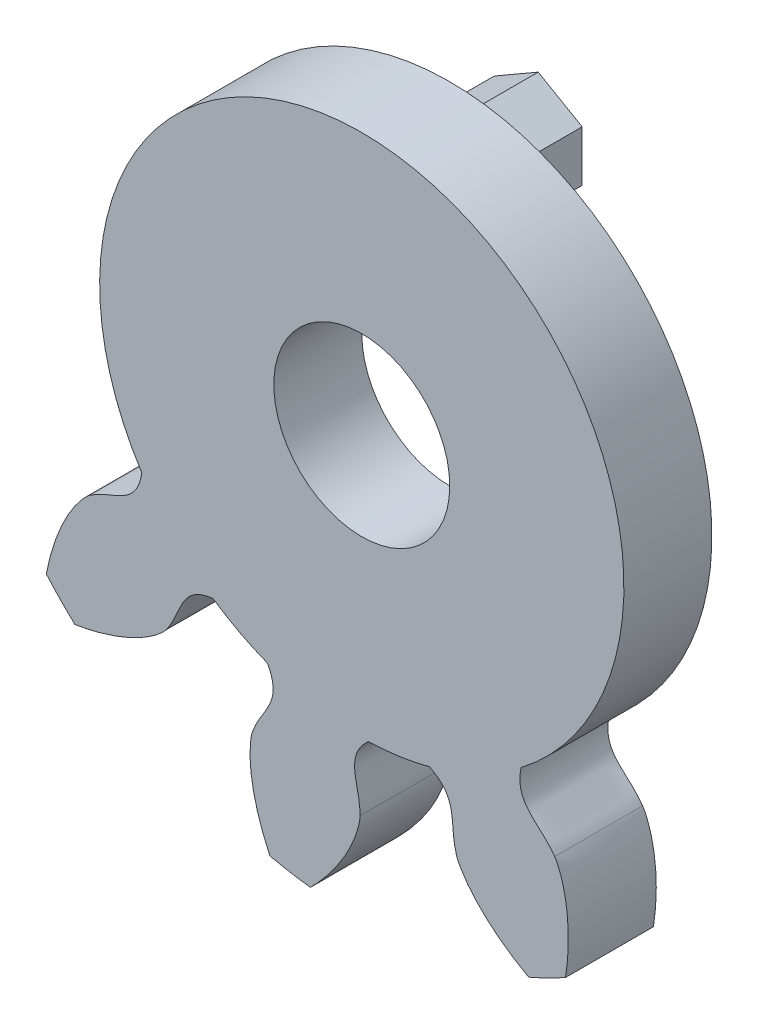
from build123d import *
from build123d.topology import SkipClean

# Parameters (mm, degrees)
EXTRUDE_1_DEPTH     = 5
SKETCH_5_R          = 5
CUT_EXTRUDE_1_DEPTH = 10
EXTRUDE_2_DEPTH     = 10
CUT_EXTRUDE_3_DEPTH = 10


with BuildPart() as part:
    # 草图4 → 凸台-拉伸1 (new body)
    with BuildSketch(Plane.XY):
        with BuildLine():
            ThreePointArc((20.566833542, -12.174373004), (21.13707452, -11.155002498), (21.656831226, -10.10898913))
            add(Edge.make_bspline(
                [(21.656831226, -10.10898913), (21.214973707, -9.252042912), (20.69173271, -8.437352563), (19.755452634, -7.337780122), (19.418203213, -6.992089994), (18.868909604, -6.526502791), (18.677636339, -6.37933904), (18.376424515, -6.178442321), (18.274029261, -6.115060819), (18.11629372, -6.027444751), (18.063007409, -5.999513326), (17.954464986, -5.947195831), (17.899670646, -5.921978638), (17.841804659, -5.902289961)],
                knots=[0, 0, 0, 0, 0.5, 0.5, 0.75, 0.75, 0.875, 0.875, 0.9375, 0.9375, 0.96875, 0.96875, 1, 1, 1, 1], degree=3))
            add(Edge.make_bspline(
                [(17.841804659, -5.902289961), (17.511046492, -5.789750782), (17.170631647, -5.729859937), (16.483172993, -5.646219452), (16.135848963, -5.622920252), (15.630122682, -5.511407848), (15.461958863, -5.459603859), (15.148365081, -5.312867719), (15.002919519, -5.217990738), (14.741841245, -4.985999859), (14.630444656, -4.853733146), (14.43525856, -4.565733542), (14.353840199, -4.410742306), (14.280249751, -4.252583572)],
                knots=[0, 0, 0, 0, 0.25, 0.25, 0.5, 0.5, 0.625, 0.625, 0.75, 0.75, 0.875, 0.875, 1, 1, 1, 1], degree=3))
            ThreePointArc((14.280249751, -4.252583572), (14.681573357, -2.541929143), (14.878726528, -0.795925179))
            add(Edge.make_bspline(
                [(14.878726528, -0.795925179), (15.000664614, -0.672262352), (15.127767639, -0.555134906), (15.405621072, -0.350801891), (15.557919677, -0.261710824), (15.877398879, -0.13183028), (16.04766762, -0.090133275), (16.393275214, -0.056426178), (16.566163517, -0.063602505), (17.084980434, -0.128356081), (17.419918719, -0.22353618), (18.09766871, -0.376438941), (18.439049665, -0.434428929), (18.787595565, -0.439628418)],
                knots=[0, 0, 0, 0, 0.125, 0.125, 0.25, 0.25, 0.375, 0.375, 0.5, 0.5, 0.75, 0.75, 1, 1, 1, 1], degree=3))
            add(Edge.make_bspline(
                [(18.787595565, -0.439628418), (18.849126864, -0.440546321), (18.909498588, -0.435159684), (19.029853959, -0.42227647), (19.089661836, -0.413824234), (19.268291412, -0.384150296), (19.386344536, -0.358749898), (19.738276581, -0.270438871), (19.969753011, -0.19537654), (20.644401372, 0.059326264), (21.073825463, 0.269769885), (21.904041833, 0.747862743), (22.306071843, 1.017428744), (23.074960591, 1.598260617), (23.442222794, 1.909889979), (23.794834764, 2.239606787)],
                knots=[0, 0, 0, 0, 0.03125, 0.03125, 0.0625, 0.0625, 0.125, 0.125, 0.25, 0.25, 0.5, 0.5, 0.75, 0.75, 1, 1, 1, 1], degree=3))
            ThreePointArc((23.794834764, 2.239606787), (23.656998456, 3.399474086), (23.462659233, 4.551222004))
            add(Edge.make_bspline(
                [(23.462659233, 4.551222004), (22.601488641, 4.984788724), (21.69931481, 5.33633372), (20.295535852, 5.675574891), (19.819503781, 5.757013843), (19.101450624, 5.810815121), (18.86020662, 5.817445492), (18.498437007, 5.802926484), (18.378342794, 5.794016775), (18.199232628, 5.772185039), (18.139705417, 5.763461128), (18.0211413, 5.741987236), (17.961989454, 5.730181068), (17.903602173, 5.712096769)],
                knots=[0, 0, 0, 0, 0.5, 0.5, 0.75, 0.75, 0.875, 0.875, 0.9375, 0.9375, 0.96875, 0.96875, 1, 1, 1, 1], degree=3))
            add(Edge.make_bspline(
                [(17.903602173, 5.712096769), (17.569864325, 5.608728104), (17.259259976, 5.45708999), (16.653931597, 5.120678506), (16.359245629, 4.935376012), (15.884559126, 4.728332992), (15.718062118, 4.671399087), (15.37811008, 4.605785318), (15.204674859, 4.597051652), (14.857097281, 4.631278256), (14.689231123, 4.672807002), (14.362040335, 4.791076068), (14.205069935, 4.868610099), (14.052570641, 4.953307823)],
                knots=[0, 0, 0, 0, 0.25, 0.25, 0.5, 0.5, 0.625, 0.625, 0.75, 0.75, 0.875, 0.875, 1, 1, 1, 1], degree=3))
            ThreePointArc((14.052570641, 4.953307823), (13.371750812, 6.573148425), (12.504975698, 8.10157903))
            add(Edge.make_bspline(
                [(12.504975698, 8.10157903), (12.530938496, 8.273297768), (12.564921218, 8.442765145), (12.669605435, 8.771392177), (12.740451179, 8.932987238), (12.922573414, 9.225847969), (13.035814835, 9.359663009), (13.295604717, 9.59007567), (13.439692431, 9.685891094), (13.897485331, 9.938457284), (14.224401555, 10.058326751), (14.862586803, 10.332997268), (15.172855457, 10.486741073), (15.457891196, 10.687404738)],
                knots=[0, 0, 0, 0, 0.125, 0.125, 0.25, 0.25, 0.375, 0.375, 0.5, 0.5, 0.75, 0.75, 1, 1, 1, 1], degree=3))
            add(Edge.make_bspline(
                [(15.457891196, 10.687404738), (15.508210592, 10.722829329), (15.553886157, 10.762672818), (15.643683135, 10.84383867), (15.687100625, 10.88583086), (15.814173084, 11.014833411), (15.894750088, 11.104772649), (16.127561174, 11.383078237), (16.270709008, 11.57986337), (16.666800446, 12.182470624), (16.890516176, 12.605132238), (17.281159398, 13.479906423), (17.447961588, 13.934297211), (17.728601242, 14.856141533), (17.842551463, 15.324126289), (17.934017862, 15.798132906)],
                knots=[0, 0, 0, 0, 0.03125, 0.03125, 0.0625, 0.0625, 0.125, 0.125, 0.25, 0.25, 0.5, 0.5, 0.75, 0.75, 1, 1, 1, 1], degree=3))
            ThreePointArc((17.934017862, 15.798132906), (17.140753053, 16.655467113), (16.306548879, 17.473021023))
            add(Edge.make_bspline(
                [(16.306548879, 17.473021023), (15.355003111, 17.317600494), (14.418496186, 17.071721898), (13.083414195, 16.521053201), (12.650427544, 16.307134066), (12.037886741, 15.928599158), (11.838819007, 15.792163573), (11.554675301, 15.567774605), (11.462754037, 15.489976893), (11.330683241, 15.367036333), (11.287652502, 15.324989324), (11.204354154, 15.237926341), (11.163438796, 15.193606368), (11.126832178, 15.14465668)],
                knots=[0, 0, 0, 0, 0.5, 0.5, 0.75, 0.75, 0.875, 0.875, 0.9375, 0.9375, 0.96875, 0.96875, 1, 1, 1, 1], degree=3))
            add(Edge.make_bspline(
                [(11.126832178, 15.14465668), (10.917591164, 14.864863488), (10.755437614, 14.559617021), (10.463454378, 13.93165132), (10.333966495, 13.608526386), (10.07163388, 13.162011339), (9.970399881, 13.018086357), (9.733939711, 12.765184908), (9.59876119, 12.656176558), (9.297447129, 12.479565488), (9.13723057, 12.414493698), (8.80301085, 12.317857462), (8.630445768, 12.288318925), (8.457287174, 12.267203987)],
                knots=[0, 0, 0, 0, 0.25, 0.25, 0.5, 0.5, 0.625, 0.625, 0.75, 0.75, 0.875, 0.875, 1, 1, 1, 1], degree=3))
            ThreePointArc((8.457287174, 12.267203987), (6.954373946, 13.177506707), (5.35474918, 13.904555412))
            add(Edge.make_bspline(
                [(5.35474918, 13.904555412), (5.274819783, 14.058739339), (5.202701957, 14.21581587), (5.094231145, 14.543212562), (5.056563362, 14.715587797), (5.031764127, 15.059565868), (5.044723854, 15.234386147), (5.119465119, 15.573494567), (5.179715635, 15.735703507), (5.40162319, 16.209117762), (5.595646466, 16.498250733), (5.950501898, 17.095579727), (6.11114617, 17.402332416), (6.223797785, 17.732212535)],
                knots=[0, 0, 0, 0, 0.125, 0.125, 0.25, 0.25, 0.375, 0.375, 0.5, 0.5, 0.75, 0.75, 1, 1, 1, 1], degree=3))
            add(Edge.make_bspline(
                [(6.223797785, 17.732212535), (6.243684979, 17.790448631), (6.257217872, 17.849530114), (6.282157063, 17.967976007), (6.292600159, 18.027468562), (6.319578142, 18.206525135), (6.331901349, 18.326649482), (6.356665554, 18.688646355), (6.356807185, 18.931989058), (6.323048233, 19.652325273), (6.255603797, 20.125762509), (6.057461437, 21.063084016), (5.92532304, 21.528737752), (5.610518792, 22.439481325), (5.42763192, 22.885067205), (5.223015692, 23.322309214)],
                knots=[0, 0, 0, 0, 0.03125, 0.03125, 0.0625, 0.0625, 0.125, 0.125, 0.25, 0.25, 0.5, 0.5, 0.75, 0.75, 1, 1, 1, 1], degree=3))
            ThreePointArc((5.223015692, 23.322309214), (4.077322577, 23.549637802), (2.921891092, 23.720719897))
            add(Edge.make_bspline(
                [(2.921891092, 23.720719897), (2.24342829, 23.035677479), (1.630302085, 22.286292557), (0.873873005, 21.056050718), (0.649317958, 20.628483335), (0.376259275, 19.96219971), (0.29540492, 19.734811925), (0.197420359, 19.386261957), (0.168782842, 19.269292323), (0.134197972, 19.092202054), (0.124099985, 19.032892476), (0.107884543, 18.913495502), (0.10083395, 18.853590447), (0.099990479, 18.792472487)],
                knots=[0, 0, 0, 0, 0.5, 0.5, 0.75, 0.75, 0.875, 0.875, 0.9375, 0.9375, 0.96875, 0.96875, 1, 1, 1, 1], degree=3))
            add(Edge.make_bspline(
                [(0.099990479, 18.792472487), (0.095169254, 18.443126258), (0.143403648, 18.100865213), (0.276293226, 17.421206849), (0.361463398, 17.083682218), (0.411686815, 16.568248715), (0.414383771, 16.392307107), (0.371735217, 16.048717736), (0.326446996, 15.881072187), (0.186488183, 15.561082869), (0.095118502, 15.414265754), (-0.118469577, 15.139635974), (-0.240715344, 15.014307585), (-0.36839254, 14.895445174)],
                knots=[0, 0, 0, 0, 0.25, 0.25, 0.5, 0.5, 0.625, 0.625, 0.75, 0.75, 0.875, 0.875, 1, 1, 1, 1], degree=3))
            ThreePointArc((-0.36839254, 14.895445174), (-2.119337396, 14.748505314), (-3.840809524, 14.396464226))
            add(Edge.make_bspline(
                [(-3.840809524, 14.396464226), (-3.996100803, 14.474220321), (-4.146772618, 14.558908111), (-4.426966296, 14.760020055), (-4.558759792, 14.877333982), (-4.781008033, 15.141041462), (-4.873280176, 15.290091575), (-5.01213615, 15.608367863), (-5.058736481, 15.775012017), (-5.157475415, 16.288446183), (-5.170455384, 16.63640369), (-5.234472482, 17.328231787), (-5.284813243, 17.67082426), (-5.387574842, 18.00391784)],
                knots=[0, 0, 0, 0, 0.125, 0.125, 0.25, 0.25, 0.375, 0.375, 0.5, 0.5, 0.75, 0.75, 1, 1, 1, 1], degree=3))
            add(Edge.make_bspline(
                [(-5.387574842, 18.00391784), (-5.405716081, 18.06272123), (-5.429494965, 18.118473589), (-5.478939485, 18.228957218), (-5.50545969, 18.283226005), (-5.588880856, 18.443943075), (-5.649518492, 18.548369113), (-5.842260252, 18.85578677), (-5.985178922, 19.052738401), (-6.435893492, 19.615659626), (-6.768736612, 19.959035551), (-7.479980907, 20.600879422), (-7.860587514, 20.899932207), (-8.650591142, 21.451701941), (-9.060458539, 21.704690283), (-9.483000949, 21.938156099)],
                knots=[0, 0, 0, 0, 0.03125, 0.03125, 0.0625, 0.0625, 0.125, 0.125, 0.25, 0.25, 0.5, 0.5, 0.75, 0.75, 1, 1, 1, 1], degree=3))
            ThreePointArc((-9.483000949, 21.938156099), (-10.54350654, 21.448647273), (-11.57882978, 20.907910009))
            add(Edge.make_bspline(
                [(-11.57882978, 20.907910009), (-11.725059887, 19.954908621), (-11.780612, 18.988256942), (-11.669457972, 17.54835253), (-11.599809018, 17.070453106), (-11.429086445, 16.370918463), (-11.360843806, 16.139432884), (-11.23524245, 15.799856156), (-11.189657661, 15.688393024), (-11.113546361, 15.524795511), (-11.086854509, 15.470877606), (-11.029793297, 15.364752227), (-11.000286038, 15.312143785), (-10.965044185, 15.262202537)],
                knots=[0, 0, 0, 0, 0.5, 0.5, 0.75, 0.75, 0.875, 0.875, 0.9375, 0.9375, 0.96875, 0.96875, 1, 1, 1, 1], degree=3))
            add(Edge.make_bspline(
                [(-10.965044185, 15.262202537), (-10.763604077, 14.976741656), (-10.523405638, 14.72819812), (-10.016402548, 14.256453487), (-9.749106431, 14.033452096), (-9.405510622, 13.645978216), (-9.299912855, 13.505223696), (-9.132459495, 13.202185865), (-9.070558854, 13.039938018), (-8.995702911, 12.698795495), (-8.9833256, 12.526312204), (-8.994698652, 12.178588122), (-9.019931376, 12.005341066), (-9.053358825, 11.834132583)],
                knots=[0, 0, 0, 0, 0.25, 0.25, 0.5, 0.5, 0.625, 0.625, 0.75, 0.75, 0.875, 0.875, 1, 1, 1, 1], degree=3))
            ThreePointArc((-9.053358825, 11.834132583), (-10.383533888, 10.686076174), (-11.569309534, 9.389413023))
            add(Edge.make_bspline(
                [(-11.569309534, 9.389413023), (-11.740646704, 9.361041102), (-11.912320996, 9.340992292), (-12.257213078, 9.339001561), (-12.432791653, 9.356444247), (-12.767597625, 9.439153842), (-12.929856815, 9.505501712), (-13.229271766, 9.681375144), (-13.364923202, 9.78880211), (-13.746593708, 10.146141786), (-13.961619014, 10.420015888), (-14.420056287, 10.94208827), (-14.662153622, 11.189661846), (-14.941076995, 11.39873846)],
                knots=[0, 0, 0, 0, 0.125, 0.125, 0.25, 0.25, 0.375, 0.375, 0.5, 0.5, 0.75, 0.75, 1, 1, 1, 1], degree=3))
            add(Edge.make_bspline(
                [(-14.941076995, 11.39873846), (-14.990317332, 11.435648249), (-15.042325268, 11.466775978), (-15.147267372, 11.527096351), (-15.200621061, 11.555412537), (-15.362577326, 11.636401647), (-15.473014289, 11.685242178), (-15.809641213, 11.820657523), (-16.04103011, 11.895989253), (-16.736542651, 12.086478713), (-17.207649696, 12.168635395), (-18.160324779, 12.269839087), (-18.64402081, 12.288062921), (-19.607469283, 12.270101532), (-20.087761789, 12.233859389), (-20.566833542, 12.174373004)],
                knots=[0, 0, 0, 0, 0.03125, 0.03125, 0.0625, 0.0625, 0.125, 0.125, 0.25, 0.25, 0.5, 0.5, 0.75, 0.75, 1, 1, 1, 1], degree=3))
            ThreePointArc((-20.566833542, 12.174373004), (-21.13707452, 11.155002498), (-21.656831226, 10.10898913))
            add(Edge.make_bspline(
                [(-21.656831226, 10.10898913), (-21.214973707, 9.252042912), (-20.69173271, 8.437352563), (-19.755452634, 7.337780122), (-19.418203213, 6.992089994), (-18.868909604, 6.526502791), (-18.677636339, 6.37933904), (-18.376424515, 6.178442321), (-18.274029261, 6.115060819), (-18.11629372, 6.027444751), (-18.063007409, 5.999513326), (-17.954464986, 5.947195831), (-17.899670646, 5.921978638), (-17.841804659, 5.902289961)],
                knots=[0, 0, 0, 0, 0.5, 0.5, 0.75, 0.75, 0.875, 0.875, 0.9375, 0.9375, 0.96875, 0.96875, 1, 1, 1, 1], degree=3))
            add(Edge.make_bspline(
                [(-17.841804659, 5.902289961), (-17.511046492, 5.789750782), (-17.170631647, 5.729859937), (-16.483172993, 5.646219452), (-16.135848963, 5.622920252), (-15.630122682, 5.511407848), (-15.461958863, 5.459603859), (-15.148365081, 5.312867719), (-15.002919519, 5.217990738), (-14.741841245, 4.985999859), (-14.630444656, 4.853733146), (-14.43525856, 4.565733542), (-14.353840199, 4.410742306), (-14.280249751, 4.252583572)],
                knots=[0, 0, 0, 0, 0.25, 0.25, 0.5, 0.5, 0.625, 0.625, 0.75, 0.75, 0.875, 0.875, 1, 1, 1, 1], degree=3))
            ThreePointArc((-14.280249751, 4.252583572), (-14.681573357, 2.541929143), (-14.878726528, 0.795925179))
            add(Edge.make_bspline(
                [(-14.878726528, 0.795925179), (-15.000664614, 0.672262352), (-15.127767639, 0.555134906), (-15.405621072, 0.350801891), (-15.557919677, 0.261710824), (-15.877398879, 0.13183028), (-16.04766762, 0.090133275), (-16.393275214, 0.056426178), (-16.566163517, 0.063602505), (-17.084980434, 0.128356081), (-17.419918719, 0.22353618), (-18.09766871, 0.376438941), (-18.439049665, 0.434428929), (-18.787595565, 0.439628418)],
                knots=[0, 0, 0, 0, 0.125, 0.125, 0.25, 0.25, 0.375, 0.375, 0.5, 0.5, 0.75, 0.75, 1, 1, 1, 1], degree=3))
            add(Edge.make_bspline(
                [(-18.787595565, 0.439628418), (-18.849126864, 0.440546321), (-18.909498588, 0.435159684), (-19.029853959, 0.42227647), (-19.089661836, 0.413824234), (-19.268291412, 0.384150296), (-19.386344536, 0.358749898), (-19.738276581, 0.270438871), (-19.969753011, 0.19537654), (-20.644401372, -0.059326264), (-21.073825463, -0.269769885), (-21.904041833, -0.747862743), (-22.306071843, -1.017428744), (-23.074960591, -1.598260617), (-23.442222794, -1.909889979), (-23.794834764, -2.239606787)],
                knots=[0, 0, 0, 0, 0.03125, 0.03125, 0.0625, 0.0625, 0.125, 0.125, 0.25, 0.25, 0.5, 0.5, 0.75, 0.75, 1, 1, 1, 1], degree=3))
            ThreePointArc((-23.794834764, -2.239606787), (-23.656998456, -3.399474086), (-23.462659233, -4.551222004))
            add(Edge.make_bspline(
                [(-23.462659233, -4.551222004), (-22.601488641, -4.984788724), (-21.69931481, -5.33633372), (-20.295535852, -5.675574891), (-19.819503781, -5.757013843), (-19.101450624, -5.810815121), (-18.86020662, -5.817445492), (-18.498437007, -5.802926484), (-18.378342794, -5.794016775), (-18.199232628, -5.772185039), (-18.139705417, -5.763461128), (-18.0211413, -5.741987236), (-17.961989454, -5.730181068), (-17.903602173, -5.712096769)],
                knots=[0, 0, 0, 0, 0.5, 0.5, 0.75, 0.75, 0.875, 0.875, 0.9375, 0.9375, 0.96875, 0.96875, 1, 1, 1, 1], degree=3))
            add(Edge.make_bspline(
                [(-17.903602173, -5.712096769), (-17.569864325, -5.608728104), (-17.259259976, -5.45708999), (-16.653931597, -5.120678506), (-16.359245629, -4.935376012), (-15.884559126, -4.728332992), (-15.718062118, -4.671399087), (-15.37811008, -4.605785318), (-15.204674859, -4.597051652), (-14.857097281, -4.631278256), (-14.689231123, -4.672807002), (-14.362040335, -4.791076068), (-14.205069935, -4.868610099), (-14.052570641, -4.953307823)],
                knots=[0, 0, 0, 0, 0.25, 0.25, 0.5, 0.5, 0.625, 0.625, 0.75, 0.75, 0.875, 0.875, 1, 1, 1, 1], degree=3))
            ThreePointArc((-14.052570641, -4.953307823), (-13.371750812, -6.573148425), (-12.504975698, -8.10157903))
            add(Edge.make_bspline(
                [(-12.504975698, -8.10157903), (-12.530938496, -8.273297768), (-12.564921218, -8.442765145), (-12.669605435, -8.771392177), (-12.740451179, -8.932987238), (-12.922573414, -9.225847969), (-13.035814835, -9.359663009), (-13.295604717, -9.59007567), (-13.439692431, -9.685891094), (-13.897485331, -9.938457284), (-14.224401555, -10.058326751), (-14.862586803, -10.332997268), (-15.172855457, -10.486741073), (-15.457891196, -10.687404738)],
                knots=[0, 0, 0, 0, 0.125, 0.125, 0.25, 0.25, 0.375, 0.375, 0.5, 0.5, 0.75, 0.75, 1, 1, 1, 1], degree=3))
            add(Edge.make_bspline(
                [(-15.457891196, -10.687404738), (-15.508210592, -10.722829329), (-15.553886157, -10.762672818), (-15.643683135, -10.84383867), (-15.687100625, -10.88583086), (-15.814173084, -11.014833411), (-15.894750088, -11.104772649), (-16.127561174, -11.383078237), (-16.270709008, -11.57986337), (-16.666800446, -12.182470624), (-16.890516176, -12.605132238), (-17.281159398, -13.479906423), (-17.447961588, -13.934297211), (-17.728601242, -14.856141533), (-17.842551463, -15.324126289), (-17.934017862, -15.798132906)],
                knots=[0, 0, 0, 0, 0.03125, 0.03125, 0.0625, 0.0625, 0.125, 0.125, 0.25, 0.25, 0.5, 0.5, 0.75, 0.75, 1, 1, 1, 1], degree=3))
            ThreePointArc((-17.934017862, -15.798132906), (-17.140753053, -16.655467113), (-16.306548879, -17.473021023))
            add(Edge.make_bspline(
                [(-16.306548879, -17.473021023), (-15.355003111, -17.317600494), (-14.418496186, -17.071721898), (-13.083414195, -16.521053201), (-12.650427544, -16.307134066), (-12.037886741, -15.928599158), (-11.838819007, -15.792163573), (-11.554675301, -15.567774605), (-11.462754037, -15.489976893), (-11.330683241, -15.367036333), (-11.287652502, -15.324989324), (-11.204354154, -15.237926341), (-11.163438796, -15.193606368), (-11.126832178, -15.14465668)],
                knots=[0, 0, 0, 0, 0.5, 0.5, 0.75, 0.75, 0.875, 0.875, 0.9375, 0.9375, 0.96875, 0.96875, 1, 1, 1, 1], degree=3))
            add(Edge.make_bspline(
                [(-11.126832178, -15.14465668), (-10.917591164, -14.864863488), (-10.755437614, -14.559617021), (-10.463454378, -13.93165132), (-10.333966495, -13.608526386), (-10.07163388, -13.162011339), (-9.970399881, -13.018086357), (-9.733939711, -12.765184908), (-9.59876119, -12.656176558), (-9.297447129, -12.479565488), (-9.13723057, -12.414493698), (-8.80301085, -12.317857462), (-8.630445768, -12.288318925), (-8.457287174, -12.267203987)],
                knots=[0, 0, 0, 0, 0.25, 0.25, 0.5, 0.5, 0.625, 0.625, 0.75, 0.75, 0.875, 0.875, 1, 1, 1, 1], degree=3))
            ThreePointArc((-8.457287174, -12.267203987), (-6.954373946, -13.177506707), (-5.35474918, -13.904555412))
            add(Edge.make_bspline(
                [(-5.35474918, -13.904555412), (-5.274819783, -14.058739339), (-5.202701957, -14.21581587), (-5.094231145, -14.543212562), (-5.056563362, -14.715587797), (-5.031764127, -15.059565868), (-5.044723854, -15.234386147), (-5.119465119, -15.573494567), (-5.179715635, -15.735703507), (-5.40162319, -16.209117762), (-5.595646466, -16.498250733), (-5.950501898, -17.095579727), (-6.11114617, -17.402332416), (-6.223797785, -17.732212535)],
                knots=[0, 0, 0, 0, 0.125, 0.125, 0.25, 0.25, 0.375, 0.375, 0.5, 0.5, 0.75, 0.75, 1, 1, 1, 1], degree=3))
            add(Edge.make_bspline(
                [(-6.223797785, -17.732212535), (-6.243684979, -17.790448631), (-6.257217872, -17.849530114), (-6.282157063, -17.967976007), (-6.292600159, -18.027468562), (-6.319578142, -18.206525135), (-6.331901349, -18.326649482), (-6.356665554, -18.688646355), (-6.356807185, -18.931989058), (-6.323048233, -19.652325273), (-6.255603797, -20.125762509), (-6.057461437, -21.063084016), (-5.92532304, -21.528737752), (-5.610518792, -22.439481325), (-5.42763192, -22.885067205), (-5.223015692, -23.322309214)],
                knots=[0, 0, 0, 0, 0.03125, 0.03125, 0.0625, 0.0625, 0.125, 0.125, 0.25, 0.25, 0.5, 0.5, 0.75, 0.75, 1, 1, 1, 1], degree=3))
            ThreePointArc((-5.223015692, -23.322309214), (-4.077322577, -23.549637802), (-2.921891092, -23.720719897))
            add(Edge.make_bspline(
                [(-2.921891092, -23.720719897), (-2.24342829, -23.035677479), (-1.630302085, -22.286292557), (-0.873873005, -21.056050718), (-0.649317958, -20.628483335), (-0.376259275, -19.96219971), (-0.29540492, -19.734811925), (-0.197420359, -19.386261957), (-0.168782842, -19.269292323), (-0.134197972, -19.092202054), (-0.124099985, -19.032892476), (-0.107884543, -18.913495502), (-0.10083395, -18.853590447), (-0.099990479, -18.792472487)],
                knots=[0, 0, 0, 0, 0.5, 0.5, 0.75, 0.75, 0.875, 0.875, 0.9375, 0.9375, 0.96875, 0.96875, 1, 1, 1, 1], degree=3))
            add(Edge.make_bspline(
                [(-0.099990479, -18.792472487), (-0.095169254, -18.443126258), (-0.143403648, -18.100865213), (-0.276293226, -17.421206849), (-0.361463398, -17.083682218), (-0.411686815, -16.568248715), (-0.414383771, -16.392307107), (-0.371735217, -16.048717736), (-0.326446996, -15.881072187), (-0.186488183, -15.561082869), (-0.095118502, -15.414265754), (0.118469577, -15.139635974), (0.240715344, -15.014307585), (0.36839254, -14.895445174)],
                knots=[0, 0, 0, 0, 0.25, 0.25, 0.5, 0.5, 0.625, 0.625, 0.75, 0.75, 0.875, 0.875, 1, 1, 1, 1], degree=3))
            ThreePointArc((0.36839254, -14.895445174), (2.119337396, -14.748505314), (3.840809524, -14.396464226))
            add(Edge.make_bspline(
                [(3.840809524, -14.396464226), (3.996100803, -14.474220321), (4.146772618, -14.558908111), (4.426966296, -14.760020055), (4.558759792, -14.877333982), (4.781008033, -15.141041462), (4.873280176, -15.290091575), (5.01213615, -15.608367863), (5.058736481, -15.775012017), (5.157475415, -16.288446183), (5.170455384, -16.63640369), (5.234472482, -17.328231787), (5.284813243, -17.67082426), (5.387574842, -18.00391784)],
                knots=[0, 0, 0, 0, 0.125, 0.125, 0.25, 0.25, 0.375, 0.375, 0.5, 0.5, 0.75, 0.75, 1, 1, 1, 1], degree=3))
            add(Edge.make_bspline(
                [(5.387574842, -18.00391784), (5.405716081, -18.06272123), (5.429494965, -18.118473589), (5.478939485, -18.228957218), (5.50545969, -18.283226005), (5.588880856, -18.443943075), (5.649518492, -18.548369113), (5.842260252, -18.85578677), (5.985178922, -19.052738401), (6.435893492, -19.615659626), (6.768736612, -19.959035551), (7.479980907, -20.600879422), (7.860587514, -20.899932207), (8.650591142, -21.451701941), (9.060458539, -21.704690283), (9.483000949, -21.938156099)],
                knots=[0, 0, 0, 0, 0.03125, 0.03125, 0.0625, 0.0625, 0.125, 0.125, 0.25, 0.25, 0.5, 0.5, 0.75, 0.75, 1, 1, 1, 1], degree=3))
            ThreePointArc((9.483000949, -21.938156099), (10.54350654, -21.448647273), (11.57882978, -20.907910009))
            add(Edge.make_bspline(
                [(11.57882978, -20.907910009), (11.725059887, -19.954908621), (11.780612, -18.988256942), (11.669457972, -17.54835253), (11.599809018, -17.070453106), (11.429086445, -16.370918463), (11.360843806, -16.139432884), (11.23524245, -15.799856156), (11.189657661, -15.688393024), (11.113546361, -15.524795511), (11.086854509, -15.470877606), (11.029793297, -15.364752227), (11.000286038, -15.312143785), (10.965044185, -15.262202537)],
                knots=[0, 0, 0, 0, 0.5, 0.5, 0.75, 0.75, 0.875, 0.875, 0.9375, 0.9375, 0.96875, 0.96875, 1, 1, 1, 1], degree=3))
            add(Edge.make_bspline(
                [(10.965044185, -15.262202537), (10.763604077, -14.976741656), (10.523405638, -14.72819812), (10.016402548, -14.256453487), (9.749106431, -14.033452096), (9.405510622, -13.645978216), (9.299912855, -13.505223696), (9.132459495, -13.202185865), (9.070558854, -13.039938018), (8.995702911, -12.698795495), (8.9833256, -12.526312204), (8.994698652, -12.178588122), (9.019931376, -12.005341066), (9.053358825, -11.834132583)],
                knots=[0, 0, 0, 0, 0.25, 0.25, 0.5, 0.5, 0.625, 0.625, 0.75, 0.75, 0.875, 0.875, 1, 1, 1, 1], degree=3))
            ThreePointArc((9.053358825, -11.834132583), (10.383533888, -10.686076174), (11.569309534, -9.389413023))
            add(Edge.make_bspline(
                [(11.569309534, -9.389413023), (11.740646704, -9.361041102), (11.912320996, -9.340992292), (12.257213078, -9.339001561), (12.432791653, -9.356444247), (12.767597625, -9.439153842), (12.929856814, -9.505501712), (13.229271766, -9.681375144), (13.364923202, -9.78880211), (13.746593708, -10.146141785), (13.961619014, -10.420015888), (14.420056287, -10.94208827), (14.662153621, -11.189661846), (14.941076995, -11.39873846)],
                knots=[0, 0, 0, 0, 0.125, 0.125, 0.25, 0.25, 0.375, 0.375, 0.5, 0.5, 0.75, 0.75, 1, 1, 1, 1], degree=3))
            add(Edge.make_bspline(
                [(14.941076995, -11.39873846), (14.990317332, -11.435648249), (15.042325267, -11.466775978), (15.147267372, -11.527096351), (15.20062106, -11.555412537), (15.362577326, -11.636401647), (15.473014288, -11.685242178), (15.809641213, -11.820657522), (16.04103011, -11.895989253), (16.736542651, -12.086478713), (17.207649696, -12.168635395), (18.160324779, -12.269839087), (18.64402081, -12.288062921), (19.607469283, -12.270101532), (20.087761789, -12.233859389), (20.566833542, -12.174373004)],
                knots=[0, 0, 0, 0, 0.03125, 0.03125, 0.0625, 0.0625, 0.125, 0.125, 0.25, 0.25, 0.5, 0.5, 0.75, 0.75, 1, 1, 1, 1], degree=3))
        make_face()
    extrude(amount=EXTRUDE_1_DEPTH)

    # 草图5 → 切除-拉伸1 (cut)
    with BuildSketch(Plane.XY.offset(5)):
        Circle(SKETCH_5_R)
    extrude(amount=-CUT_EXTRUDE_1_DEPTH, mode=Mode.SUBTRACT)

    # 草图6 → 凸台-拉伸2 (add)
    with BuildSketch(Plane.XY.offset(5)):
        Polygon((0.026847426, 7.113248654), (2.526847426, 8.556624327), (2.526847426, 11.443375673), (0.026847426, 12.886751346), (-2.473152574, 11.443375673), (-2.473152574, 8.556624327), align=None)
    extrude(amount=-EXTRUDE_2_DEPTH)

    # 草图7 → 切除-拉伸3 (cut)
    with SkipClean():  # the faces are left unmerged after this step: merging them gives an invalid solid
        with BuildSketch(Plane.XY):
            with BuildLine():
                ThreePointArc((14.052570641, 4.953307823), (14.748505314, 2.119337396), (14.878726528, -0.795925179))
                add(Edge.make_bspline(
                    [(14.878726528, -0.795925179), (15.000664614, -0.672262352), (15.127767639, -0.555134906), (15.405621072, -0.350801891), (15.557919677, -0.261710824), (15.877398879, -0.13183028), (16.04766762, -0.090133275), (16.393275214, -0.056426178), (16.566163517, -0.063602505), (17.084980434, -0.128356081), (17.419918719, -0.22353618), (18.09766871, -0.376438941), (18.439049665, -0.434428929), (18.787595565, -0.439628418)],
                    knots=[0, 0, 0, 0, 0.125, 0.125, 0.25, 0.25, 0.375, 0.375, 0.5, 0.5, 0.75, 0.75, 1, 1, 1, 1], degree=3))
                add(Edge.make_bspline(
                    [(18.787595565, -0.439628418), (18.849126864, -0.440546321), (18.909498588, -0.435159684), (19.029853959, -0.42227647), (19.089661836, -0.413824234), (19.268291412, -0.384150296), (19.386344536, -0.358749898), (19.738276581, -0.270438871), (19.969753011, -0.19537654), (20.644401372, 0.059326264), (21.073825463, 0.269769885), (21.904041833, 0.747862743), (22.306071843, 1.017428744), (23.074960591, 1.598260617), (23.442222794, 1.909889979), (23.794834764, 2.239606787)],
                    knots=[0, 0, 0, 0, 0.03125, 0.03125, 0.0625, 0.0625, 0.125, 0.125, 0.25, 0.25, 0.5, 0.5, 0.75, 0.75, 1, 1, 1, 1], degree=3))
                ThreePointArc((23.794834764, 2.239606787), (23.656998456, 3.399474086), (23.462659233, 4.551222004))
                add(Edge.make_bspline(
                    [(23.462659233, 4.551222004), (22.601488641, 4.984788724), (21.69931481, 5.33633372), (20.295535852, 5.675574891), (19.819503781, 5.757013843), (19.101450624, 5.810815121), (18.86020662, 5.817445492), (18.498437007, 5.802926484), (18.378342794, 5.794016775), (18.199232628, 5.772185039), (18.139705417, 5.763461128), (18.0211413, 5.741987236), (17.961989454, 5.730181068), (17.903602173, 5.712096769)],
                    knots=[0, 0, 0, 0, 0.5, 0.5, 0.75, 0.75, 0.875, 0.875, 0.9375, 0.9375, 0.96875, 0.96875, 1, 1, 1, 1], degree=3))
                add(Edge.make_bspline(
                    [(17.903602173, 5.712096769), (17.569864325, 5.608728104), (17.259259976, 5.45708999), (16.653931597, 5.120678506), (16.359245629, 4.935376012), (15.884559126, 4.728332992), (15.718062118, 4.671399087), (15.37811008, 4.605785318), (15.204674859, 4.597051652), (14.857097281, 4.631278256), (14.689231123, 4.672807002), (14.362040335, 4.791076068), (14.205069935, 4.868610099), (14.052570641, 4.953307823)],
                    knots=[0, 0, 0, 0, 0.25, 0.25, 0.5, 0.5, 0.625, 0.625, 0.75, 0.75, 0.875, 0.875, 1, 1, 1, 1], degree=3))
            make_face()
            with BuildLine():
                ThreePointArc((8.457287174, 12.267203987), (10.686076174, 10.383533888), (12.504975698, 8.10157903))
                add(Edge.make_bspline(
                    [(12.504975698, 8.10157903), (12.530938496, 8.273297768), (12.564921218, 8.442765145), (12.669605435, 8.771392177), (12.740451179, 8.932987238), (12.922573414, 9.225847969), (13.035814835, 9.359663009), (13.295604717, 9.59007567), (13.439692431, 9.685891094), (13.897485331, 9.938457284), (14.224401555, 10.058326751), (14.862586803, 10.332997268), (15.172855457, 10.486741073), (15.457891196, 10.687404738)],
                    knots=[0, 0, 0, 0, 0.125, 0.125, 0.25, 0.25, 0.375, 0.375, 0.5, 0.5, 0.75, 0.75, 1, 1, 1, 1], degree=3))
                add(Edge.make_bspline(
                    [(15.457891196, 10.687404738), (15.508210592, 10.722829329), (15.553886157, 10.762672818), (15.643683135, 10.84383867), (15.687100625, 10.88583086), (15.814173084, 11.014833411), (15.894750088, 11.104772649), (16.127561174, 11.383078237), (16.270709008, 11.57986337), (16.666800446, 12.182470624), (16.890516176, 12.605132238), (17.281159398, 13.479906423), (17.447961588, 13.934297211), (17.728601242, 14.856141533), (17.842551463, 15.324126289), (17.934017862, 15.798132906)],
                    knots=[0, 0, 0, 0, 0.03125, 0.03125, 0.0625, 0.0625, 0.125, 0.125, 0.25, 0.25, 0.5, 0.5, 0.75, 0.75, 1, 1, 1, 1], degree=3))
                ThreePointArc((17.934017862, 15.798132906), (17.140753053, 16.655467113), (16.306548879, 17.473021023))
                add(Edge.make_bspline(
                    [(16.306548879, 17.473021023), (15.355003111, 17.317600494), (14.418496186, 17.071721898), (13.083414195, 16.521053201), (12.650427544, 16.307134066), (12.037886741, 15.928599158), (11.838819007, 15.792163573), (11.554675301, 15.567774605), (11.462754037, 15.489976893), (11.330683241, 15.367036333), (11.287652502, 15.324989324), (11.204354154, 15.237926341), (11.163438796, 15.193606368), (11.126832178, 15.14465668)],
                    knots=[0, 0, 0, 0, 0.5, 0.5, 0.75, 0.75, 0.875, 0.875, 0.9375, 0.9375, 0.96875, 0.96875, 1, 1, 1, 1], degree=3))
                add(Edge.make_bspline(
                    [(11.126832178, 15.14465668), (10.917591164, 14.864863488), (10.755437614, 14.559617021), (10.463454378, 13.93165132), (10.333966495, 13.608526386), (10.07163388, 13.162011339), (9.970399881, 13.018086357), (9.733939711, 12.765184908), (9.59876119, 12.656176558), (9.297447129, 12.479565488), (9.13723057, 12.414493698), (8.80301085, 12.317857462), (8.630445768, 12.288318925), (8.457287174, 12.267203987)],
                    knots=[0, 0, 0, 0, 0.25, 0.25, 0.5, 0.5, 0.625, 0.625, 0.75, 0.75, 0.875, 0.875, 1, 1, 1, 1], degree=3))
            make_face()
            with BuildLine():
                add(Edge.make_bspline(
                    [(17.841804659, -5.902289961), (17.511046492, -5.789750782), (17.170631647, -5.729859937), (16.483172993, -5.646219452), (16.135848963, -5.622920252), (15.630122682, -5.511407848), (15.461958863, -5.459603859), (15.148365081, -5.312867719), (15.002919519, -5.217990738), (14.741841245, -4.985999859), (14.630444656, -4.853733146), (14.43525856, -4.565733542), (14.353840199, -4.410742306), (14.280249751, -4.252583572)],
                    knots=[0, 0, 0, 0, 0.25, 0.25, 0.5, 0.5, 0.625, 0.625, 0.75, 0.75, 0.875, 0.875, 1, 1, 1, 1], degree=3))
                ThreePointArc((14.280249751, -4.252583572), (13.177506707, -6.954373946), (11.569309534, -9.389413023))
                add(Edge.make_bspline(
                    [(11.569309534, -9.389413023), (11.740646704, -9.361041102), (11.912320996, -9.340992292), (12.257213078, -9.339001561), (12.432791653, -9.356444247), (12.767597625, -9.439153842), (12.929856815, -9.505501712), (13.229271766, -9.681375144), (13.364923202, -9.78880211), (13.746593708, -10.146141786), (13.961619014, -10.420015888), (14.420056287, -10.94208827), (14.662153622, -11.189661846), (14.941076995, -11.39873846)],
                    knots=[0, 0, 0, 0, 0.125, 0.125, 0.25, 0.25, 0.375, 0.375, 0.5, 0.5, 0.75, 0.75, 1, 1, 1, 1], degree=3))
                add(Edge.make_bspline(
                    [(14.941076995, -11.39873846), (14.990317332, -11.435648249), (15.042325268, -11.466775978), (15.147267372, -11.527096351), (15.200621061, -11.555412537), (15.362577326, -11.636401647), (15.473014289, -11.685242178), (15.809641213, -11.820657523), (16.04103011, -11.895989253), (16.736542651, -12.086478713), (17.207649696, -12.168635395), (18.160324779, -12.269839087), (18.64402081, -12.288062921), (19.607469283, -12.270101532), (20.087761789, -12.233859389), (20.566833542, -12.174373004)],
                    knots=[0, 0, 0, 0, 0.03125, 0.03125, 0.0625, 0.0625, 0.125, 0.125, 0.25, 0.25, 0.5, 0.5, 0.75, 0.75, 1, 1, 1, 1], degree=3))
                ThreePointArc((20.566833542, -12.174373004), (21.13707452, -11.155002498), (21.656831226, -10.10898913))
                add(Edge.make_bspline(
                    [(21.656831226, -10.10898913), (21.214973707, -9.252042912), (20.69173271, -8.437352563), (19.755452634, -7.337780122), (19.418203213, -6.992089994), (18.868909604, -6.526502791), (18.677636339, -6.37933904), (18.376424515, -6.178442321), (18.274029261, -6.115060819), (18.11629372, -6.027444751), (18.063007409, -5.999513326), (17.954464986, -5.947195831), (17.899670646, -5.921978638), (17.841804659, -5.902289961)],
                    knots=[0, 0, 0, 0, 0.5, 0.5, 0.75, 0.75, 0.875, 0.875, 0.9375, 0.9375, 0.96875, 0.96875, 1, 1, 1, 1], degree=3))
            make_face()
            with BuildLine():
                ThreePointArc((-0.36839254, 14.895445174), (2.541929143, 14.681573357), (5.35474918, 13.904555412))
                add(Edge.make_bspline(
                    [(5.35474918, 13.904555412), (5.274819783, 14.058739339), (5.202701957, 14.21581587), (5.094231145, 14.543212562), (5.056563362, 14.715587797), (5.031764127, 15.059565868), (5.044723854, 15.234386147), (5.119465119, 15.573494567), (5.179715635, 15.735703507), (5.40162319, 16.209117762), (5.595646466, 16.498250733), (5.950501898, 17.095579727), (6.11114617, 17.402332416), (6.223797785, 17.732212535)],
                    knots=[0, 0, 0, 0, 0.125, 0.125, 0.25, 0.25, 0.375, 0.375, 0.5, 0.5, 0.75, 0.75, 1, 1, 1, 1], degree=3))
                add(Edge.make_bspline(
                    [(6.223797785, 17.732212535), (6.243684979, 17.790448631), (6.257217872, 17.849530114), (6.282157063, 17.967976007), (6.292600159, 18.027468562), (6.319578142, 18.206525135), (6.331901349, 18.326649482), (6.356665554, 18.688646355), (6.356807185, 18.931989058), (6.323048233, 19.652325273), (6.255603797, 20.125762509), (6.057461437, 21.063084016), (5.92532304, 21.528737752), (5.610518792, 22.439481325), (5.42763192, 22.885067205), (5.223015692, 23.322309214)],
                    knots=[0, 0, 0, 0, 0.03125, 0.03125, 0.0625, 0.0625, 0.125, 0.125, 0.25, 0.25, 0.5, 0.5, 0.75, 0.75, 1, 1, 1, 1], degree=3))
                ThreePointArc((5.223015692, 23.322309214), (4.077322577, 23.549637802), (2.921891092, 23.720719897))
                add(Edge.make_bspline(
                    [(2.921891092, 23.720719897), (2.24342829, 23.035677479), (1.630302085, 22.286292557), (0.873873005, 21.056050718), (0.649317958, 20.628483335), (0.376259275, 19.96219971), (0.29540492, 19.734811925), (0.197420359, 19.386261957), (0.168782842, 19.269292323), (0.134197972, 19.092202054), (0.124099985, 19.032892476), (0.107884543, 18.913495502), (0.10083395, 18.853590447), (0.099990479, 18.792472487)],
                    knots=[0, 0, 0, 0, 0.5, 0.5, 0.75, 0.75, 0.875, 0.875, 0.9375, 0.9375, 0.96875, 0.96875, 1, 1, 1, 1], degree=3))
                add(Edge.make_bspline(
                    [(0.099990479, 18.792472487), (0.095169254, 18.443126258), (0.143403648, 18.100865213), (0.276293226, 17.421206849), (0.361463398, 17.083682218), (0.411686815, 16.568248715), (0.414383771, 16.392307107), (0.371735217, 16.048717736), (0.326446996, 15.881072187), (0.186488183, 15.561082869), (0.095118502, 15.414265754), (-0.118469577, 15.139635974), (-0.240715344, 15.014307585), (-0.36839254, 14.895445174)],
                    knots=[0, 0, 0, 0, 0.25, 0.25, 0.5, 0.5, 0.625, 0.625, 0.75, 0.75, 0.875, 0.875, 1, 1, 1, 1], degree=3))
            make_face()
            with BuildLine():
                add(Edge.make_bspline(
                    [(-17.903602173, -5.712096769), (-17.569864325, -5.608728104), (-17.259259976, -5.45708999), (-16.653931597, -5.120678506), (-16.359245629, -4.935376012), (-15.884559126, -4.728332992), (-15.718062118, -4.671399087), (-15.37811008, -4.605785318), (-15.204674859, -4.597051652), (-14.857097281, -4.631278256), (-14.689231123, -4.672807002), (-14.362040335, -4.791076068), (-14.205069935, -4.868610099), (-14.052570641, -4.953307823)],
                    knots=[0, 0, 0, 0, 0.25, 0.25, 0.5, 0.5, 0.625, 0.625, 0.75, 0.75, 0.875, 0.875, 1, 1, 1, 1], degree=3))
                ThreePointArc((-14.052570641, -4.953307823), (-14.748505314, -2.119337396), (-14.878726528, 0.795925179))
                add(Edge.make_bspline(
                    [(-14.878726528, 0.795925179), (-15.000664614, 0.672262352), (-15.127767639, 0.555134906), (-15.405621072, 0.350801891), (-15.557919677, 0.261710824), (-15.877398879, 0.13183028), (-16.04766762, 0.090133275), (-16.393275214, 0.056426178), (-16.566163517, 0.063602505), (-17.084980434, 0.128356081), (-17.419918719, 0.22353618), (-18.09766871, 0.376438941), (-18.439049665, 0.434428929), (-18.787595565, 0.439628418)],
                    knots=[0, 0, 0, 0, 0.125, 0.125, 0.25, 0.25, 0.375, 0.375, 0.5, 0.5, 0.75, 0.75, 1, 1, 1, 1], degree=3))
                add(Edge.make_bspline(
                    [(-18.787595565, 0.439628418), (-18.849126864, 0.440546321), (-18.909498588, 0.435159684), (-19.029853959, 0.42227647), (-19.089661836, 0.413824234), (-19.268291412, 0.384150296), (-19.386344536, 0.358749898), (-19.738276581, 0.270438871), (-19.969753011, 0.19537654), (-20.644401372, -0.059326264), (-21.073825463, -0.269769885), (-21.904041833, -0.747862743), (-22.306071843, -1.017428744), (-23.074960591, -1.598260617), (-23.442222794, -1.909889979), (-23.794834764, -2.239606787)],
                    knots=[0, 0, 0, 0, 0.03125, 0.03125, 0.0625, 0.0625, 0.125, 0.125, 0.25, 0.25, 0.5, 0.5, 0.75, 0.75, 1, 1, 1, 1], degree=3))
                ThreePointArc((-23.794834764, -2.239606787), (-23.656998456, -3.399474086), (-23.462659233, -4.551222004))
                add(Edge.make_bspline(
                    [(-23.462659233, -4.551222004), (-22.601488641, -4.984788724), (-21.69931481, -5.33633372), (-20.295535852, -5.675574891), (-19.819503781, -5.757013843), (-19.101450624, -5.810815121), (-18.86020662, -5.817445492), (-18.498437007, -5.802926484), (-18.378342794, -5.794016775), (-18.199232628, -5.772185039), (-18.139705417, -5.763461128), (-18.0211413, -5.741987236), (-17.961989454, -5.730181068), (-17.903602173, -5.712096769)],
                    knots=[0, 0, 0, 0, 0.5, 0.5, 0.75, 0.75, 0.875, 0.875, 0.9375, 0.9375, 0.96875, 0.96875, 1, 1, 1, 1], degree=3))
            make_face()
            with BuildLine():
                ThreePointArc((-9.053358825, 11.834132583), (-6.573148425, 13.371750812), (-3.840809524, 14.396464226))
                add(Edge.make_bspline(
                    [(-3.840809524, 14.396464226), (-3.996100803, 14.474220321), (-4.146772618, 14.558908111), (-4.426966296, 14.760020055), (-4.558759792, 14.877333982), (-4.781008033, 15.141041462), (-4.873280176, 15.290091575), (-5.01213615, 15.608367863), (-5.058736481, 15.775012017), (-5.157475415, 16.288446183), (-5.170455384, 16.63640369), (-5.234472482, 17.328231787), (-5.284813243, 17.67082426), (-5.387574842, 18.00391784)],
                    knots=[0, 0, 0, 0, 0.125, 0.125, 0.25, 0.25, 0.375, 0.375, 0.5, 0.5, 0.75, 0.75, 1, 1, 1, 1], degree=3))
                add(Edge.make_bspline(
                    [(-5.387574842, 18.00391784), (-5.405716081, 18.06272123), (-5.429494965, 18.118473589), (-5.478939485, 18.228957218), (-5.50545969, 18.283226005), (-5.588880856, 18.443943075), (-5.649518492, 18.548369113), (-5.842260252, 18.85578677), (-5.985178922, 19.052738401), (-6.435893492, 19.615659626), (-6.768736612, 19.959035551), (-7.479980907, 20.600879422), (-7.860587514, 20.899932207), (-8.650591142, 21.451701941), (-9.060458539, 21.704690283), (-9.483000949, 21.938156099)],
                    knots=[0, 0, 0, 0, 0.03125, 0.03125, 0.0625, 0.0625, 0.125, 0.125, 0.25, 0.25, 0.5, 0.5, 0.75, 0.75, 1, 1, 1, 1], degree=3))
                ThreePointArc((-9.483000949, 21.938156099), (-10.54350654, 21.448647273), (-11.57882978, 20.907910009))
                add(Edge.make_bspline(
                    [(-11.57882978, 20.907910009), (-11.725059887, 19.954908621), (-11.780612, 18.988256942), (-11.669457972, 17.54835253), (-11.599809018, 17.070453106), (-11.429086445, 16.370918463), (-11.360843806, 16.139432884), (-11.23524245, 15.799856156), (-11.189657661, 15.688393024), (-11.113546361, 15.524795511), (-11.086854509, 15.470877606), (-11.029793297, 15.364752227), (-11.000286038, 15.312143785), (-10.965044185, 15.262202537)],
                    knots=[0, 0, 0, 0, 0.5, 0.5, 0.75, 0.75, 0.875, 0.875, 0.9375, 0.9375, 0.96875, 0.96875, 1, 1, 1, 1], degree=3))
                add(Edge.make_bspline(
                    [(-10.965044185, 15.262202537), (-10.763604077, 14.976741656), (-10.523405638, 14.72819812), (-10.016402548, 14.256453487), (-9.749106431, 14.033452096), (-9.405510622, 13.645978216), (-9.299912855, 13.505223696), (-9.132459495, 13.202185865), (-9.070558854, 13.039938018), (-8.995702911, 12.698795495), (-8.9833256, 12.526312204), (-8.994698652, 12.178588122), (-9.019931376, 12.005341066), (-9.053358825, 11.834132583)],
                    knots=[0, 0, 0, 0, 0.25, 0.25, 0.5, 0.5, 0.625, 0.625, 0.75, 0.75, 0.875, 0.875, 1, 1, 1, 1], degree=3))
            make_face()
            with BuildLine():
                add(Edge.make_bspline(
                    [(-17.841804659, 5.902289961), (-17.511046492, 5.789750782), (-17.170631647, 5.729859937), (-16.483172993, 5.646219452), (-16.135848963, 5.622920252), (-15.630122682, 5.511407848), (-15.461958863, 5.459603859), (-15.148365081, 5.312867719), (-15.002919519, 5.217990738), (-14.741841245, 4.985999859), (-14.630444656, 4.853733146), (-14.43525856, 4.565733542), (-14.353840199, 4.410742306), (-14.280249751, 4.252583572)],
                    knots=[0, 0, 0, 0, 0.25, 0.25, 0.5, 0.5, 0.625, 0.625, 0.75, 0.75, 0.875, 0.875, 1, 1, 1, 1], degree=3))
                ThreePointArc((-14.280249751, 4.252583572), (-13.177506707, 6.954373946), (-11.569309534, 9.389413023))
                add(Edge.make_bspline(
                    [(-11.569309534, 9.389413023), (-11.740646704, 9.361041102), (-11.912320996, 9.340992292), (-12.257213078, 9.339001561), (-12.432791653, 9.356444247), (-12.767597625, 9.439153842), (-12.929856815, 9.505501712), (-13.229271766, 9.681375144), (-13.364923202, 9.78880211), (-13.746593708, 10.146141786), (-13.961619014, 10.420015888), (-14.420056287, 10.94208827), (-14.662153622, 11.189661846), (-14.941076995, 11.39873846)],
                    knots=[0, 0, 0, 0, 0.125, 0.125, 0.25, 0.25, 0.375, 0.375, 0.5, 0.5, 0.75, 0.75, 1, 1, 1, 1], degree=3))
                add(Edge.make_bspline(
                    [(-14.941076995, 11.39873846), (-14.990317332, 11.435648249), (-15.042325268, 11.466775978), (-15.147267372, 11.527096351), (-15.200621061, 11.555412537), (-15.362577326, 11.636401647), (-15.473014289, 11.685242178), (-15.809641213, 11.820657523), (-16.04103011, 11.895989253), (-16.736542651, 12.086478713), (-17.207649696, 12.168635395), (-18.160324779, 12.269839087), (-18.64402081, 12.288062921), (-19.607469283, 12.270101532), (-20.087761789, 12.233859389), (-20.566833542, 12.174373004)],
                    knots=[0, 0, 0, 0, 0.03125, 0.03125, 0.0625, 0.0625, 0.125, 0.125, 0.25, 0.25, 0.5, 0.5, 0.75, 0.75, 1, 1, 1, 1], degree=3))
                ThreePointArc((-20.566833542, 12.174373004), (-21.13707452, 11.155002498), (-21.656831226, 10.10898913))
                add(Edge.make_bspline(
                    [(-21.656831226, 10.10898913), (-21.214973707, 9.252042912), (-20.69173271, 8.437352563), (-19.755452634, 7.337780122), (-19.418203213, 6.992089994), (-18.868909604, 6.526502791), (-18.677636339, 6.37933904), (-18.376424515, 6.178442321), (-18.274029261, 6.115060819), (-18.11629372, 6.027444751), (-18.063007409, 5.999513326), (-17.954464986, 5.947195831), (-17.899670646, 5.921978638), (-17.841804659, 5.902289961)],
                    knots=[0, 0, 0, 0, 0.5, 0.5, 0.75, 0.75, 0.875, 0.875, 0.9375, 0.9375, 0.96875, 0.96875, 1, 1, 1, 1], degree=3))
            make_face()
        extrude(amount=CUT_EXTRUDE_3_DEPTH, mode=Mode.SUBTRACT)


solid = part.part
